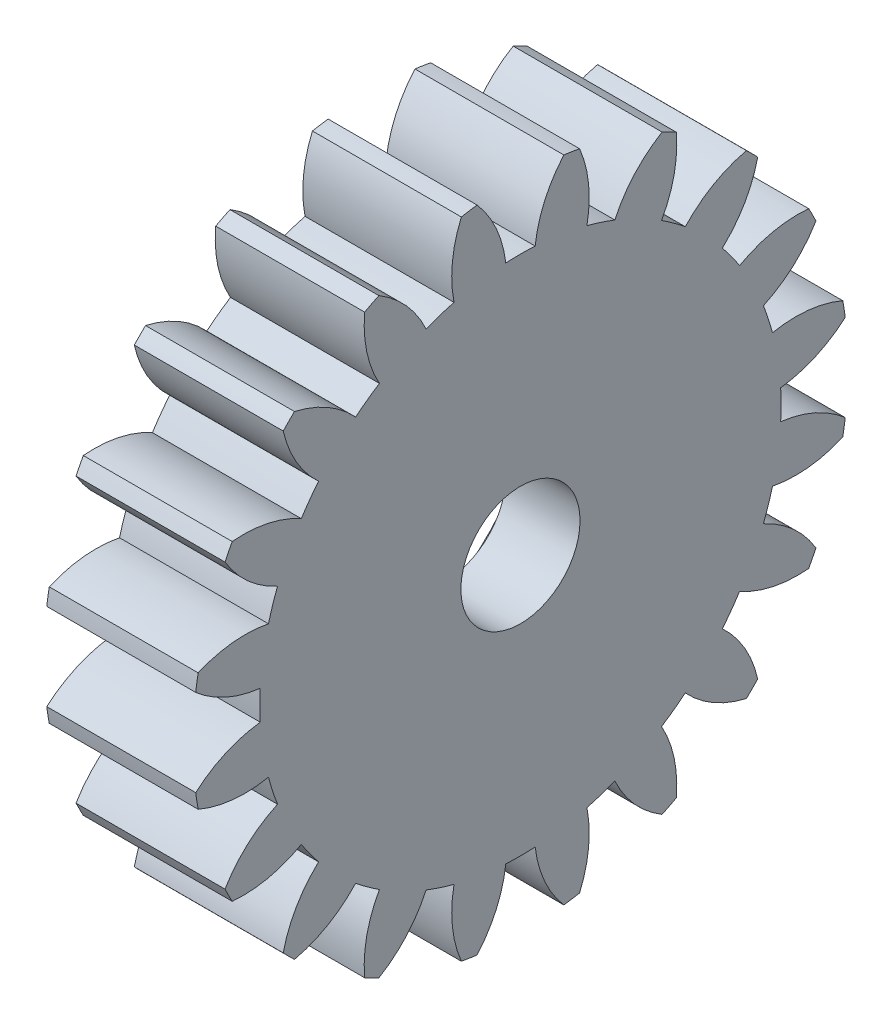
from build123d import *

# Parameters (mm, degrees)
SKETCH1_R           = 11
BOSS_EXTRUDE1_DEPTH = 10
SKETCH2_R           = 11
BOSS_EXTRUDE2_DEPTH = 5
SKETCH3_R           = 4
CUT_EXTRUDE1_DEPTH  = 5


with BuildPart() as part:
    # Sketch1 → Boss-Extrude1 (new body)
    with BuildSketch(Plane(origin=(-18.166693136, 0, 0), x_dir=(0, 0, -1), z_dir=(1, 0, 0))):
        with BuildLine():
            ThreePointArc((-32.070699567, 5.798220619), (-30.049213728, 4.506228855), (-27.735555242, 3.871695857))
            ThreePointArc((-27.735555242, 3.871695857), (-27.763365626, 2.885524266), (-27.735555242, 1.899352675))
            ThreePointArc((-27.735555242, 1.899352675), (-30.049213728, 1.264819676), (-32.070699567, -0.027172088))
            ThreePointArc((-32.070699567, -0.027172088), (-31.993509119, -0.556033965), (-31.90349429, -1.08286466))
            ThreePointArc((-31.90349429, -1.08286466), (-29.581699598, -1.686948368), (-27.185198138, -1.575465319))
            ThreePointArc((-27.185198138, -1.575465319), (-26.906903604, -2.521964119), (-26.575710576, -3.451275156))
            ThreePointArc((-26.575710576, -3.451275156), (-28.580049076, -4.76971169), (-30.103348944, -6.623142354))
            ThreePointArc((-30.103348944, -6.623142354), (-29.866509158, -7.102266728), (-29.61810033, -7.575496382))
            ThreePointArc((-29.61810033, -7.575496382), (-27.223270227, -7.432540112), (-24.978512054, -6.585953754))
            ThreePointArc((-24.978512054, -6.585953754), (-24.42135401, -7.400129864), (-23.819197819, -8.181612907))
            ThreePointArc((-23.819197819, -8.181612907), (-25.318017715, -10.054895223), (-26.194020408, -12.288338081))
            ThreePointArc((-26.194020408, -12.288338081), (-25.820714812, -12.67082492), (-25.438227972, -13.044130517))
            ThreePointArc((-25.438227972, -13.044130517), (-23.204785115, -12.168127824), (-21.331502799, -10.669307928))
            ThreePointArc((-21.331502799, -10.669307928), (-20.550019756, -11.271464119), (-19.735843645, -11.828622163))
            ThreePointArc((-19.735843645, -11.828622163), (-20.582430003, -14.073380336), (-20.725386273, -16.468210439))
            ThreePointArc((-20.725386273, -16.468210439), (-20.25215662, -16.716619266), (-19.773032246, -16.953459053))
            ThreePointArc((-19.773032246, -16.953459053), (-17.919601581, -15.430159185), (-16.601165047, -13.425820685))
            ThreePointArc((-16.601165047, -13.425820685), (-15.67185401, -13.757013713), (-14.725355211, -14.035308247))
            ThreePointArc((-14.725355211, -14.035308247), (-14.83683826, -16.431809706), (-14.232754552, -18.753604398))
            ThreePointArc((-14.232754552, -18.753604398), (-13.705923857, -18.843619227), (-13.177061979, -18.920809675))
            ThreePointArc((-13.177061979, -18.920809675), (-11.885070215, -16.899323836), (-11.250537217, -14.58566535))
            ThreePointArc((-11.250537217, -14.58566535), (-10.264365626, -14.613475734), (-9.278194034, -14.58566535))
            ThreePointArc((-9.278194034, -14.58566535), (-8.643661036, -16.899323836), (-7.351669272, -18.920809675))
            ThreePointArc((-7.351669272, -18.920809675), (-6.822807395, -18.843619227), (-6.2959767, -18.753604398))
            ThreePointArc((-6.2959767, -18.753604398), (-5.691892992, -16.431809706), (-5.803376041, -14.035308247))
            ThreePointArc((-5.803376041, -14.035308247), (-4.856877241, -13.757013713), (-3.927566204, -13.425820685))
            ThreePointArc((-3.927566204, -13.425820685), (-2.60912967, -15.430159185), (-0.755699006, -16.953459053))
            ThreePointArc((-0.755699006, -16.953459053), (-0.276574631, -16.716619266), (0.196655022, -16.468210439))
            ThreePointArc((0.196655022, -16.468210439), (0.053698752, -14.073380336), (-0.792887606, -11.828622163))
            ThreePointArc((-0.792887606, -11.828622163), (0.021288504, -11.271464119), (0.802771547, -10.669307928))
            ThreePointArc((0.802771547, -10.669307928), (2.676053863, -12.168127824), (4.909496721, -13.044130517))
            ThreePointArc((4.909496721, -13.044130517), (5.29198356, -12.67082492), (5.665289157, -12.288338081))
            ThreePointArc((5.665289157, -12.288338081), (4.789286464, -10.054895223), (3.290466568, -8.181612907))
            ThreePointArc((3.290466568, -8.181612907), (3.892622759, -7.400129864), (4.449780803, -6.585953754))
            ThreePointArc((4.449780803, -6.585953754), (6.694538976, -7.432540112), (9.089369079, -7.575496382))
            ThreePointArc((9.089369079, -7.575496382), (9.337777906, -7.102266728), (9.574617693, -6.623142354))
            ThreePointArc((9.574617693, -6.623142354), (8.051317825, -4.76971169), (6.046979325, -3.451275156))
            ThreePointArc((6.046979325, -3.451275156), (6.378172353, -2.521964119), (6.656466887, -1.575465319))
            ThreePointArc((6.656466887, -1.575465319), (9.052968347, -1.686948368), (11.374763038, -1.08286466))
            ThreePointArc((11.374763038, -1.08286466), (11.464777867, -0.556033965), (11.541968315, -0.027172088))
            ThreePointArc((11.541968315, -0.027172088), (9.520482476, 1.264819676), (7.20682399, 1.899352675))
            ThreePointArc((7.20682399, 1.899352675), (7.234634374, 2.885524266), (7.20682399, 3.871695857))
            ThreePointArc((7.20682399, 3.871695857), (9.520482476, 4.506228855), (11.541968315, 5.798220619))
            ThreePointArc((11.541968315, 5.798220619), (11.464777867, 6.327082497), (11.374763038, 6.853913192))
            ThreePointArc((11.374763038, 6.853913192), (9.052968347, 7.4579969), (6.656466887, 7.346513851))
            ThreePointArc((6.656466887, 7.346513851), (6.378172353, 8.29301265), (6.046979325, 9.222323687))
            ThreePointArc((6.046979325, 9.222323687), (8.051317825, 10.540760221), (9.574617693, 12.394190886))
            ThreePointArc((9.574617693, 12.394190886), (9.337777906, 12.87331526), (9.089369079, 13.346544914))
            ThreePointArc((9.089369079, 13.346544914), (6.694538976, 13.203588643), (4.449780803, 12.357002285))
            ThreePointArc((4.449780803, 12.357002285), (3.892622759, 13.171178396), (3.290466568, 13.952661439))
            ThreePointArc((3.290466568, 13.952661439), (4.789286464, 15.825943755), (5.665289157, 18.059386612))
            ThreePointArc((5.665289157, 18.059386612), (5.29198356, 18.441873452), (4.909496721, 18.815179048))
            ThreePointArc((4.909496721, 18.815179048), (2.676053863, 17.939176356), (0.802771547, 16.440356459))
            ThreePointArc((0.802771547, 16.440356459), (0.021288504, 17.04251265), (-0.792887606, 17.599670695))
            ThreePointArc((-0.792887606, 17.599670695), (0.053698752, 19.844428867), (0.196655022, 22.23925897))
            ThreePointArc((0.196655022, 22.23925897), (-0.276574631, 22.487667798), (-0.755699006, 22.724507584))
            ThreePointArc((-0.755699006, 22.724507584), (-2.60912967, 21.201207716), (-3.927566204, 19.196869216))
            ThreePointArc((-3.927566204, 19.196869216), (-4.856877241, 19.528062244), (-5.803376041, 19.806356778))
            ThreePointArc((-5.803376041, 19.806356778), (-5.691892992, 22.202858238), (-6.2959767, 24.52465293))
            ThreePointArc((-6.2959767, 24.52465293), (-6.822807395, 24.614667759), (-7.351669272, 24.691858207))
            ThreePointArc((-7.351669272, 24.691858207), (-8.643661036, 22.670372368), (-9.278194034, 20.356713882))
            ThreePointArc((-9.278194034, 20.356713882), (-10.264365626, 20.384524266), (-11.250537217, 20.356713882))
            ThreePointArc((-11.250537217, 20.356713882), (-11.885070215, 22.670372368), (-13.177061979, 24.691858207))
            ThreePointArc((-13.177061979, 24.691858207), (-13.705923857, 24.614667759), (-14.232754552, 24.52465293))
            ThreePointArc((-14.232754552, 24.52465293), (-14.83683826, 22.202858238), (-14.725355211, 19.806356778))
            ThreePointArc((-14.725355211, 19.806356778), (-15.67185401, 19.528062244), (-16.601165047, 19.196869216))
            ThreePointArc((-16.601165047, 19.196869216), (-17.919601581, 21.201207716), (-19.773032246, 22.724507584))
            ThreePointArc((-19.773032246, 22.724507584), (-20.25215662, 22.487667798), (-20.725386273, 22.23925897))
            ThreePointArc((-20.725386273, 22.23925897), (-20.582430003, 19.844428867), (-19.735843645, 17.599670695))
            ThreePointArc((-19.735843645, 17.599670695), (-20.550019756, 17.04251265), (-21.331502799, 16.440356459))
            ThreePointArc((-21.331502799, 16.440356459), (-23.204785115, 17.939176356), (-25.438227972, 18.815179048))
            ThreePointArc((-25.438227972, 18.815179048), (-25.820714812, 18.441873452), (-26.194020408, 18.059386612))
            ThreePointArc((-26.194020408, 18.059386612), (-25.318017715, 15.825943755), (-23.819197819, 13.952661439))
            ThreePointArc((-23.819197819, 13.952661439), (-24.42135401, 13.171178396), (-24.978512054, 12.357002285))
            ThreePointArc((-24.978512054, 12.357002285), (-27.223270227, 13.203588643), (-29.61810033, 13.346544914))
            ThreePointArc((-29.61810033, 13.346544914), (-29.866509158, 12.87331526), (-30.103348944, 12.394190886))
            ThreePointArc((-30.103348944, 12.394190886), (-28.580049076, 10.540760221), (-26.575710576, 9.222323687))
            ThreePointArc((-26.575710576, 9.222323687), (-26.906903604, 8.29301265), (-27.185198138, 7.346513851))
            ThreePointArc((-27.185198138, 7.346513851), (-29.581699598, 7.4579969), (-31.90349429, 6.853913192))
            ThreePointArc((-31.90349429, 6.853913192), (-31.993509119, 6.327082497), (-32.070699567, 5.798220619))
        make_face()
        with Locations(Location((-10.264365626, 2.885524266, 0), (0, 0, 180))):
            Circle(SKETCH1_R, mode=Mode.SUBTRACT)
    extrude(amount=-BOSS_EXTRUDE1_DEPTH)

    # Sketch2 → Boss-Extrude2 (add)
    with BuildSketch(Plane(origin=(-18.166693136, 0, 0), x_dir=(0, 0, -1), z_dir=(1, 0, 0))):
        with Locations((-10.264365626, 2.885524266)):
            Circle(SKETCH2_R)
    extrude(amount=-BOSS_EXTRUDE2_DEPTH)

    # Sketch3 → Cut-Extrude1 (cut)
    with BuildSketch(Plane(origin=(-18.166693136, 0, 0), x_dir=(0, 0, -1), z_dir=(1, 0, 0))):
        with Locations((-10.264365626, 2.885524266)):
            Circle(SKETCH3_R)
    extrude(amount=-CUT_EXTRUDE1_DEPTH, mode=Mode.SUBTRACT)


solid = part.part
